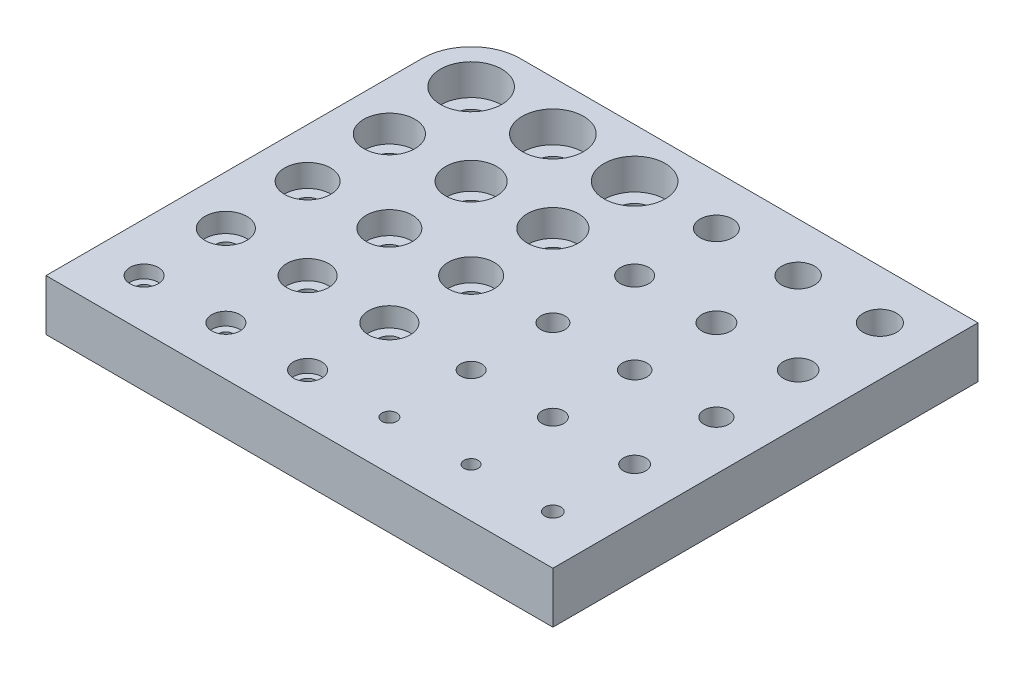
from build123d import *

# Parameters (mm, degrees)
SKETCH1_W                                       = 40.64
SKETCH1_H                                       = 66.04
SKETCH1_R                                       = 2.5527
SKETCH1_R_2                                     = 2.5908
SKETCH1_R_3                                     = 2.286
SKETCH1_R_4                                     = 2.2479
SKETCH1_R_5                                     = 1.89865
SKETCH1_R_6                                     = 1.9304
SKETCH1_R_7                                     = 1.75
SKETCH1_R_8                                     = 1.7
SKETCH1_R_9                                     = 1.1
SKETCH1_R_10                                    = 1.25
SKETCH1_R_11                                    = 2.5273
SKETCH1_R_12                                    = 2.1971
SKETCH1_R_13                                    = 1.8669
SKETCH1_R_14                                    = 1.15
SKETCH1_R_15                                    = 1.65
BOSS_EXTRUDE1_DEPTH                             = 7.9375
LPATTERN1_COUNT                                 = 2
LPATTERN1_PITCH                                 = 38.1
CBORE_FOR_10_SOCKET_HEAD_CAP_SCREW1_D           = 4.9784
CBORE_FOR_10_SOCKET_HEAD_CAP_SCREW1_CBORE_D     = 9.525
CBORE_FOR_10_SOCKET_HEAD_CAP_SCREW1_CBORE_DEPTH = 4.826
CBORE_FOR_8_SOCKET_HEAD_CAP_SCREW1_D            = 4.3053
CBORE_FOR_8_SOCKET_HEAD_CAP_SCREW1_CBORE_D      = 7.9375
CBORE_FOR_8_SOCKET_HEAD_CAP_SCREW1_CBORE_DEPTH  = 4.1656
CBORE_FOR_6_SOCKET_HEAD_CAP_SCREW1_D            = 3.6576
CBORE_FOR_6_SOCKET_HEAD_CAP_SCREW1_CBORE_D      = 7.14502
CBORE_FOR_6_SOCKET_HEAD_CAP_SCREW1_CBORE_DEPTH  = 3.5052
CBORE_FOR_M3_SHCS1_D                            = 3.2
CBORE_FOR_M3_SHCS1_CBORE_D                      = 6.5
CBORE_FOR_M3_SHCS1_CBORE_DEPTH                  = 3
CBORE_FOR_M2_SHCS1_D                            = 2.2
CBORE_FOR_M2_SHCS1_CBORE_D                      = 4.4
CBORE_FOR_M2_SHCS1_CBORE_DEPTH                  = 2
FILLET1_R                                       = 7.62


with BuildPart() as part:
    # Sketch1 → Boss-Extrude1 (new body)
    with BuildSketch(Plane(origin=(0, 0, 0), x_dir=(1, 0, 0), z_dir=(0, 1, 0))):
        with Locations((20.32, 33.02)):
            Rectangle(SKETCH1_W, SKETCH1_H)
        with Locations((20.32, 58.42)):
            Circle(SKETCH1_R, mode=Mode.SUBTRACT)
        with Locations((33.02, 58.42)):
            Circle(SKETCH1_R_2, mode=Mode.SUBTRACT)
        with Locations((33.02, 45.72)):
            Circle(SKETCH1_R_3, mode=Mode.SUBTRACT)
        with Locations((20.32, 45.72)):
            Circle(SKETCH1_R_4, mode=Mode.SUBTRACT)
        with Locations((20.32, 33.02)):
            Circle(SKETCH1_R_5, mode=Mode.SUBTRACT)
        with Locations((33.02, 33.02)):
            Circle(SKETCH1_R_6, mode=Mode.SUBTRACT)
        with Locations((33.02, 20.32)):
            Circle(SKETCH1_R_7, mode=Mode.SUBTRACT)
        with Locations((20.32, 20.32)):
            Circle(SKETCH1_R_8, mode=Mode.SUBTRACT)
        with Locations((20.32, 7.62)):
            Circle(SKETCH1_R_9, mode=Mode.SUBTRACT)
        with Locations((33.02, 7.62)):
            Circle(SKETCH1_R_10, mode=Mode.SUBTRACT)
        with Locations((7.62, 58.42)):
            Circle(SKETCH1_R_11, mode=Mode.SUBTRACT)
        with Locations((7.62, 45.72)):
            Circle(SKETCH1_R_12, mode=Mode.SUBTRACT)
        with Locations((7.62, 33.02)):
            Circle(SKETCH1_R_13, mode=Mode.SUBTRACT)
        with Locations((7.62, 7.62)):
            Circle(SKETCH1_R_14, mode=Mode.SUBTRACT)
        with Locations((7.62, 20.32)):
            Circle(SKETCH1_R_15, mode=Mode.SUBTRACT)
    extrude(amount=-BOSS_EXTRUDE1_DEPTH)


with BuildPart() as lpattern1_1:
    # LPattern1: pattern copy
    add(part.part.moved(Location(Vector(1, 0, 0) * (1 * LPATTERN1_PITCH))))

    # Combine1: union part
    add(part.part)

    # CBORE for #10 Socket Head Cap Screw1 (through all)
    with Locations(Plane(origin=(0, 0, 0), x_dir=(1, 0, 0), z_dir=(0, 1, 0))):
        with Locations((7.62, 58.42), (20.32, 58.42), (33.02, 58.42)):
            CounterBoreHole(CBORE_FOR_10_SOCKET_HEAD_CAP_SCREW1_D / 2, CBORE_FOR_10_SOCKET_HEAD_CAP_SCREW1_CBORE_D / 2, CBORE_FOR_10_SOCKET_HEAD_CAP_SCREW1_CBORE_DEPTH)

    # CBORE for #8 Socket Head Cap Screw1 (through all)
    with Locations(Plane(origin=(0, 0, 0), x_dir=(1, 0, 0), z_dir=(0, 1, 0))):
        with Locations((7.62, 45.72), (20.32, 45.72), (33.02, 45.72)):
            CounterBoreHole(CBORE_FOR_8_SOCKET_HEAD_CAP_SCREW1_D / 2, CBORE_FOR_8_SOCKET_HEAD_CAP_SCREW1_CBORE_D / 2, CBORE_FOR_8_SOCKET_HEAD_CAP_SCREW1_CBORE_DEPTH)

    # CBORE for #6 Socket Head Cap Screw1 (through all)
    with Locations(Plane(origin=(0, 0, 0), x_dir=(1, 0, 0), z_dir=(0, 1, 0))):
        with Locations((7.62, 33.02), (20.32, 33.02), (33.02, 33.02)):
            CounterBoreHole(CBORE_FOR_6_SOCKET_HEAD_CAP_SCREW1_D / 2, CBORE_FOR_6_SOCKET_HEAD_CAP_SCREW1_CBORE_D / 2, CBORE_FOR_6_SOCKET_HEAD_CAP_SCREW1_CBORE_DEPTH)

    # CBORE for M3 SHCS1 (through all)
    with Locations(Plane(origin=(0, 0, 0), x_dir=(1, 0, 0), z_dir=(0, 1, 0))):
        with Locations((7.62, 20.32), (20.32, 20.32), (33.02, 20.32)):
            CounterBoreHole(CBORE_FOR_M3_SHCS1_D / 2, CBORE_FOR_M3_SHCS1_CBORE_D / 2, CBORE_FOR_M3_SHCS1_CBORE_DEPTH)

    # CBORE for M2 SHCS1 (through all)
    with Locations(Plane(origin=(0, 0, 0), x_dir=(1, 0, 0), z_dir=(0, 1, 0))):
        with Locations((7.62, 7.62), (20.32, 7.62), (33.02, 7.62)):
            CounterBoreHole(CBORE_FOR_M2_SHCS1_D / 2, CBORE_FOR_M2_SHCS1_CBORE_D / 2, CBORE_FOR_M2_SHCS1_CBORE_DEPTH)

    # Fillet1
    fillet1_edges = [lpattern1_1.edges().sort_by_distance(p)[0] for p in [
        (0, -3.96875, -66.04),
    ]]
    fillet(fillet1_edges, radius=FILLET1_R)


solid = lpattern1_1.part
